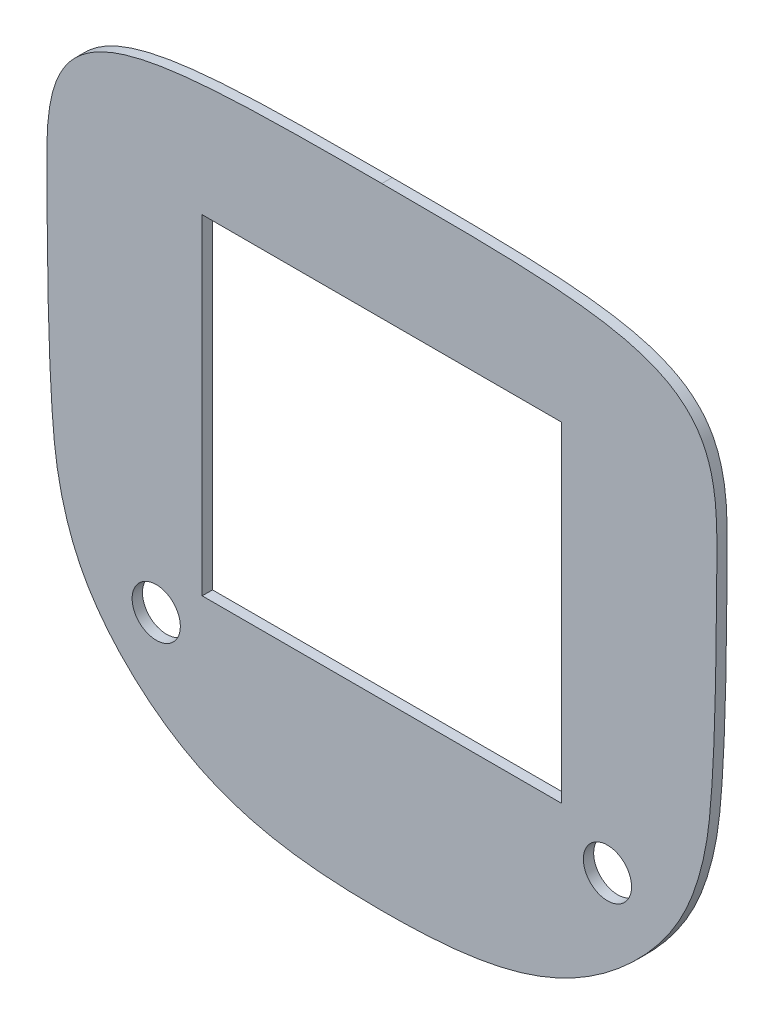
from build123d import *

# Parameters (mm, degrees)
SKETCH1_R           = 7
SKETCH1_R_2         = 7.000000001
SKETCH1_W           = 104.308156416
SKETCH1_H           = 95.831566325
BOSS_EXTRUDE1_DEPTH = 3


with BuildPart() as part:
    # Sketch1 → Boss-Extrude1 (new body)
    with BuildSketch(Plane(origin=(0, 0, 100), x_dir=(-1, 0, 0), z_dir=(0, 0, -1))):
        with BuildLine():
            add(Edge.make_bspline(
                [(-1e-09, -73.137085013), (-3.370733736, -73.137085013), (-6.734378943, -73.083771669), (-13.440672959, -72.819229501), (-16.783433063, -72.608837747), (-23.439182049, -71.964142651), (-26.752144152, -71.529637912), (-33.33759261, -70.356207321), (-36.60997649, -69.616510751), (-40.667378232, -68.443107129), (-41.477203817, -68.195980803), (-43.093366771, -67.675493026), (-43.900822122, -67.401729181), (-46.310032737, -66.541796001), (-47.889238607, -65.92044891), (-52.544477218, -63.909421833), (-55.537048564, -62.370824761), (-61.306337859, -58.908491373), (-64.084452162, -56.98724652), (-67.427542086, -54.354533899), (-68.090122652, -53.815906347), (-69.393533804, -52.722974051), (-70.035477989, -52.167844506), (-71.932790396, -50.47714376), (-73.159826692, -49.316427503), (-76.728035335, -45.734077875), (-78.958878587, -43.214525591), (-82.039575544, -39.199501195), (-83.021440244, -37.821191048), (-84.88412339, -34.974890516), (-85.767427654, -33.501005365), (-88.204559187, -29.023741799), (-89.563400092, -25.942835856), (-91.239794175, -21.190749213), (-91.74457302, -19.587205428), (-92.660442382, -16.346272129), (-93.069699195, -14.708220172), (-93.795158786, -11.398499673), (-94.111800727, -9.722957871), (-94.651697476, -6.365781752), (-94.87676845, -4.6830068), (-95.239286804, -1.309281941), (-95.39057167, 0.380376979), (-95.667624115, 3.762075486), (-95.789769063, 5.454453052), (-96.006949572, 8.841737387), (-96.101559279, 10.536683887), (-96.275518719, 13.928000585), (-96.3541526, 15.624404776), (-96.567849925, 20.713768319), (-96.680733557, 24.107568552), (-96.953354403, 34.290958559), (-97.04588188, 41.082678484), (-97.149341973, 51.270007833), (-97.178486911, 54.665842901), (-97.227652976, 59.759535712), (-97.245834664, 61.457370788), (-97.286778342, 64.853283992), (-97.310325044, 66.551469151), (-97.290358192, 69.942854821), (-97.255875699, 71.636726618), (-97.09582269, 75.017699558), (-96.972551619, 76.704971621), (-96.585320654, 80.06905822), (-96.320360567, 81.745798411), (-95.854782835, 83.831735242), (-95.754841059, 84.248415208), (-95.539629218, 85.080635775), (-95.424100672, 85.496934333), (-95.054796974, 86.733533), (-94.777904174, 87.544024069), (-93.84392333, 89.928683353), (-93.083697513, 91.456112273), (-91.917347528, 93.267482281), (-91.672560415, 93.6258059), (-91.167018785, 94.323599626), (-90.905778308, 94.663945051), (-90.097205711, 95.659890217), (-89.525112782, 96.290490077), (-88.317187597, 97.487335056), (-87.6813056, 98.053529952), (-86.682325789, 98.857229484), (-86.341828077, 99.117552429), (-85.646278974, 99.623504122), (-85.290309402, 99.869702545), (-83.492108358, 101.054683185), (-81.989735399, 101.864008562), (-78.891787842, 103.280138886), (-77.295448939, 103.885283055), (-74.849929741, 104.68215643), (-74.025694859, 104.929450071), (-72.377789623, 105.387657064), (-71.552081134, 105.599261026), (-69.070517041, 106.189836208), (-67.410275941, 106.525100239), (-64.081531041, 107.113279731), (-62.412948454, 107.365409975), (-57.397851787, 108.028626666), (-54.042298135, 108.349622004), (-47.317214164, 108.852316963), (-43.947594988, 109.033131006), (-37.200013677, 109.311610648), (-33.821984223, 109.408605309), (-27.060918817, 109.552698361), (-23.677806003, 109.599487384), (-13.530472118, 109.696626212), (-6.765261961, 109.705627481), (0, 109.705627484)],
                knots=[0, 0, 0, 0, 0.03125, 0.03125, 0.0625, 0.0625, 0.09375, 0.09375, 0.125, 0.125, 0.1328125, 0.1328125, 0.140625, 0.140625, 0.15625, 0.15625, 0.1875, 0.1875, 0.21875, 0.21875, 0.2265625, 0.2265625, 0.234375, 0.234375, 0.25, 0.25, 0.28125, 0.28125, 0.296875, 0.296875, 0.3125, 0.3125, 0.34375, 0.34375, 0.359375, 0.359375, 0.375, 0.375, 0.390625, 0.390625, 0.40625, 0.40625, 0.421875, 0.421875, 0.4375, 0.4375, 0.453125, 0.453125, 0.46875, 0.46875, 0.5, 0.5, 0.5625, 0.5625, 0.59375, 0.59375, 0.609375, 0.609375, 0.625, 0.625, 0.640625, 0.640625, 0.65625, 0.65625, 0.671875, 0.671875, 0.67578125, 0.67578125, 0.6796875, 0.6796875, 0.6875, 0.6875, 0.703125, 0.703125, 0.70703125, 0.70703125, 0.7109375, 0.7109375, 0.71875, 0.71875, 0.7265625, 0.7265625, 0.73046875, 0.73046875, 0.734375, 0.734375, 0.75, 0.75, 0.765625, 0.765625, 0.7734375, 0.7734375, 0.78125, 0.78125, 0.796875, 0.796875, 0.8125, 0.8125, 0.84375, 0.84375, 0.875, 0.875, 0.90625, 0.90625, 0.9375, 0.9375, 1, 1, 1, 1], degree=3))
            add(Edge.make_bspline(
                [(-1e-09, -73.137085013), (3.370733735, -73.137085013), (6.734378942, -73.083771669), (13.440672958, -72.819229501), (16.783433062, -72.608837747), (23.439182048, -71.964142651), (26.752144151, -71.529637912), (33.337592609, -70.356207322), (36.609976489, -69.616510752), (40.667378232, -68.44310713), (41.477203816, -68.195980803), (43.093366771, -67.675493027), (43.900822121, -67.401729181), (46.310032736, -66.541796001), (47.889238606, -65.920448911), (52.544477218, -63.909421834), (55.537048563, -62.370824761), (61.306337859, -58.908491374), (64.084452162, -56.98724652), (67.427542085, -54.3545339), (68.090122651, -53.815906348), (69.393533803, -52.722974052), (70.035477989, -52.167844506), (71.932790395, -50.47714376), (73.159826692, -49.316427504), (76.728035334, -45.734077876), (78.958878587, -43.214525592), (82.039575543, -39.199501196), (83.021440244, -37.821191049), (84.884123389, -34.974890517), (85.767427654, -33.501005366), (88.204559186, -29.0237418), (89.563400092, -25.942835857), (91.239794175, -21.190749214), (91.74457302, -19.58720543), (92.660442382, -16.34627213), (93.069699195, -14.708220173), (93.795158786, -11.398499674), (94.111800727, -9.722957872), (94.651697476, -6.365781754), (94.87676845, -4.683006801), (95.239286804, -1.309281942), (95.39057167, 0.380376978), (95.667624115, 3.762075485), (95.789769063, 5.454453051), (96.006949572, 8.841737385), (96.101559279, 10.536683886), (96.275518719, 13.928000584), (96.3541526, 15.624404775), (96.567849925, 20.713768318), (96.680733557, 24.107568551), (96.953354403, 34.290958558), (97.04588188, 41.082678483), (97.149341974, 51.270007832), (97.178486911, 54.6658429), (97.227652977, 59.759535711), (97.245834665, 61.457370787), (97.286778343, 64.853283991), (97.310325044, 66.55146915), (97.290358192, 69.94285482), (97.2558757, 71.636726617), (97.095822691, 75.017699557), (96.97255162, 76.70497162), (96.585320655, 80.069058219), (96.320360568, 81.74579841), (95.854782836, 83.83173524), (95.75484106, 84.248415207), (95.539629219, 85.080635774), (95.424100673, 85.496934331), (95.054796975, 86.733532999), (94.777904175, 87.544024068), (93.843923331, 89.928683352), (93.083697514, 91.456112272), (91.91734753, 93.26748228), (91.672560416, 93.625805898), (91.167018786, 94.323599625), (90.905778309, 94.66394505), (90.097205713, 95.659890216), (89.525112783, 96.290490076), (88.317187599, 97.487335055), (87.681305601, 98.053529951), (86.682325791, 98.857229483), (86.341828078, 99.117552428), (85.646278975, 99.623504121), (85.290309403, 99.869702544), (83.492108359, 101.054683184), (81.9897354, 101.864008561), (78.891787843, 103.280138886), (77.29544894, 103.885283054), (74.849929743, 104.682156429), (74.025694861, 104.92945007), (72.377789624, 105.387657063), (71.552081135, 105.599261025), (69.070517043, 106.189836207), (67.410275942, 106.525100238), (64.081531042, 107.11327973), (62.412948455, 107.365409974), (57.397851788, 108.028626665), (54.042298136, 108.349622003), (47.317214166, 108.852316963), (43.947594989, 109.033131006), (37.200013679, 109.311610647), (33.821984224, 109.408605308), (27.060918818, 109.55269836), (23.677806004, 109.599487383), (13.530472119, 109.696626212), (6.765261962, 109.705627481), (0, 109.705627484)],
                knots=[0, 0, 0, 0, 0.03125, 0.03125, 0.0625, 0.0625, 0.09375, 0.09375, 0.125, 0.125, 0.1328125, 0.1328125, 0.140625, 0.140625, 0.15625, 0.15625, 0.1875, 0.1875, 0.21875, 0.21875, 0.2265625, 0.2265625, 0.234375, 0.234375, 0.25, 0.25, 0.28125, 0.28125, 0.296875, 0.296875, 0.3125, 0.3125, 0.34375, 0.34375, 0.359375, 0.359375, 0.375, 0.375, 0.390625, 0.390625, 0.40625, 0.40625, 0.421875, 0.421875, 0.4375, 0.4375, 0.453125, 0.453125, 0.46875, 0.46875, 0.5, 0.5, 0.5625, 0.5625, 0.59375, 0.59375, 0.609375, 0.609375, 0.625, 0.625, 0.640625, 0.640625, 0.65625, 0.65625, 0.671875, 0.671875, 0.67578125, 0.67578125, 0.6796875, 0.6796875, 0.6875, 0.6875, 0.703125, 0.703125, 0.70703125, 0.70703125, 0.7109375, 0.7109375, 0.71875, 0.71875, 0.7265625, 0.7265625, 0.73046875, 0.73046875, 0.734375, 0.734375, 0.75, 0.75, 0.765625, 0.765625, 0.7734375, 0.7734375, 0.78125, 0.78125, 0.796875, 0.796875, 0.8125, 0.8125, 0.84375, 0.84375, 0.875, 0.875, 0.90625, 0.90625, 0.9375, 0.9375, 1, 1, 1, 1], degree=3))
        make_face()
        with Locations((-65.5, -30.887752409)):
            Circle(SKETCH1_R, mode=Mode.SUBTRACT)
        with Locations(Location((65.5, -30.887752409, 0), (0, 0, 180))):
            Circle(SKETCH1_R_2, mode=Mode.SUBTRACT)
        with Locations((0, 27.871196428)):
            Rectangle(SKETCH1_W, SKETCH1_H, mode=Mode.SUBTRACT)
    extrude(amount=BOSS_EXTRUDE1_DEPTH)


solid = part.part
